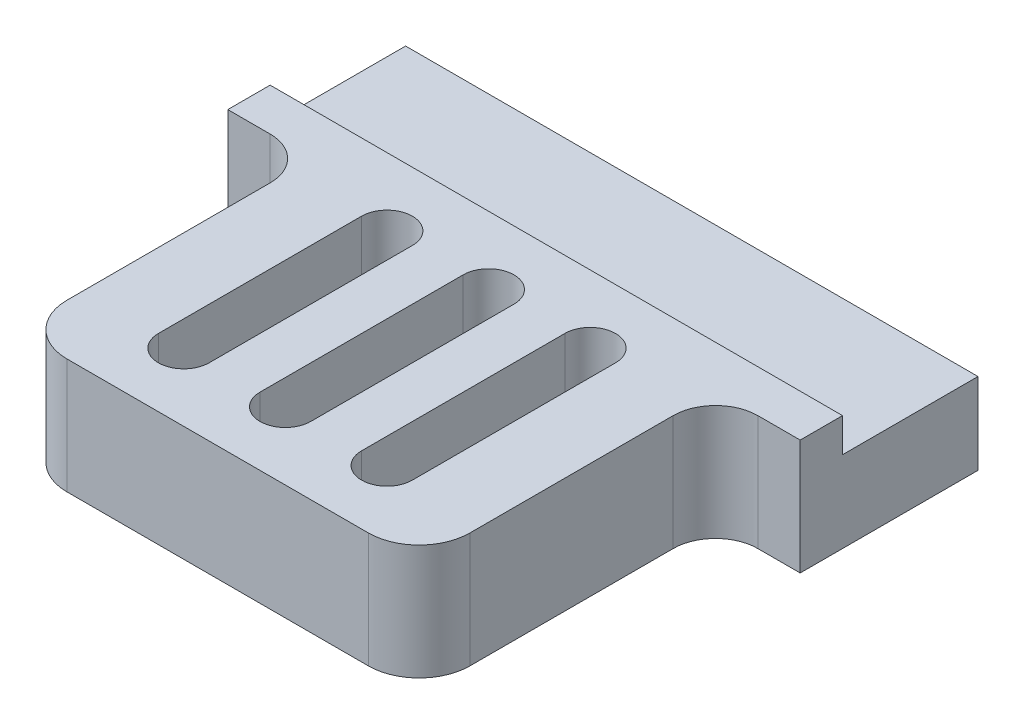
from build123d import *

# Parameters (mm, degrees)
SKETCH_1_W          = 33.8
SKETCH_1_H          = 4.8
EXTRUDE_1_DEPTH     = 28
SKETCH_2_W          = 33.8
SKETCH_2_H          = 2
EXTRUDE_2_DEPTH     = 20
CUT_EXTRUDE_1_DEPTH = 34.404341035
SKETCH_4_W          = 5
SKETCH_4_H          = 17.5
CUT_EXTRUDE_2_DEPTH = 34.404341035
FILLET_1_R          = 3
FILLET_3_R          = 2.5


with BuildPart() as part:
    # 草圖1 → 填料-伸長1 (new body)
    with BuildSketch(Plane.XY):
        Rectangle(SKETCH_1_W, SKETCH_1_H)
    extrude(amount=EXTRUDE_1_DEPTH)

    # 草圖2 → 填料-伸長2 (add)
    with BuildSketch(Plane.XY.offset(28)):
        with Locations((0, 3.4)):
            Rectangle(SKETCH_2_W, SKETCH_2_H)
    extrude(amount=-EXTRUDE_2_DEPTH)

    # 草圖3 → 除料-伸長1 (cut, through all)
    with BuildSketch(Plane(origin=(0, 4.4, 0), x_dir=(1, 0, 0), z_dir=(0, 1, 0))):
        with BuildLine():
            Line((1.5, -12), (1.5, -24))
            ThreePointArc((1.5, -24), (0, -25.5), (-1.5, -24))
            Line((-1.5, -24), (-1.5, -12))
            ThreePointArc((-1.5, -12), (0, -10.5), (1.5, -12))
        make_face()
        with BuildLine():
            Line((7.5, -12), (7.5, -24))
            ThreePointArc((7.5, -24), (6, -25.5), (4.5, -24))
            Line((4.5, -24), (4.5, -12))
            ThreePointArc((4.5, -12), (6, -10.5), (7.5, -12))
        make_face()
        with BuildLine():
            Line((-4.5, -12), (-4.5, -24))
            ThreePointArc((-4.5, -24), (-6, -25.5), (-7.5, -24))
            Line((-7.5, -24), (-7.5, -12))
            ThreePointArc((-7.5, -12), (-6, -10.5), (-4.5, -12))
        make_face()
    extrude(amount=-CUT_EXTRUDE_1_DEPTH, mode=Mode.SUBTRACT)

    # 草圖4 → 除料-伸長2 (cut, through all)
    with BuildSketch(Plane(origin=(0, 4.4, 0), x_dir=(1, 0, 0), z_dir=(0, 1, 0))):
        with Locations((-14.4, -19.25)):
            Rectangle(SKETCH_4_W, SKETCH_4_H)
        with Locations((14.4, -19.25)):
            Rectangle(SKETCH_4_W, SKETCH_4_H)
    extrude(amount=-CUT_EXTRUDE_2_DEPTH, mode=Mode.SUBTRACT)

    # 圓角1
    fillet_1_edges = [part.edges().sort_by_distance(p)[0] for p in [
        (-11.9, 1, 28),
        (11.9, 1, 28),
    ]]
    fillet(fillet_1_edges, radius=FILLET_1_R)

    # 圓角3
    fillet_3_edges = [part.edges().sort_by_distance(p)[0] for p in [
        (-11.9, 1, 10.5),
        (11.9, 1, 10.5),
    ]]
    fillet(fillet_3_edges, radius=FILLET_3_R)


solid = part.part
